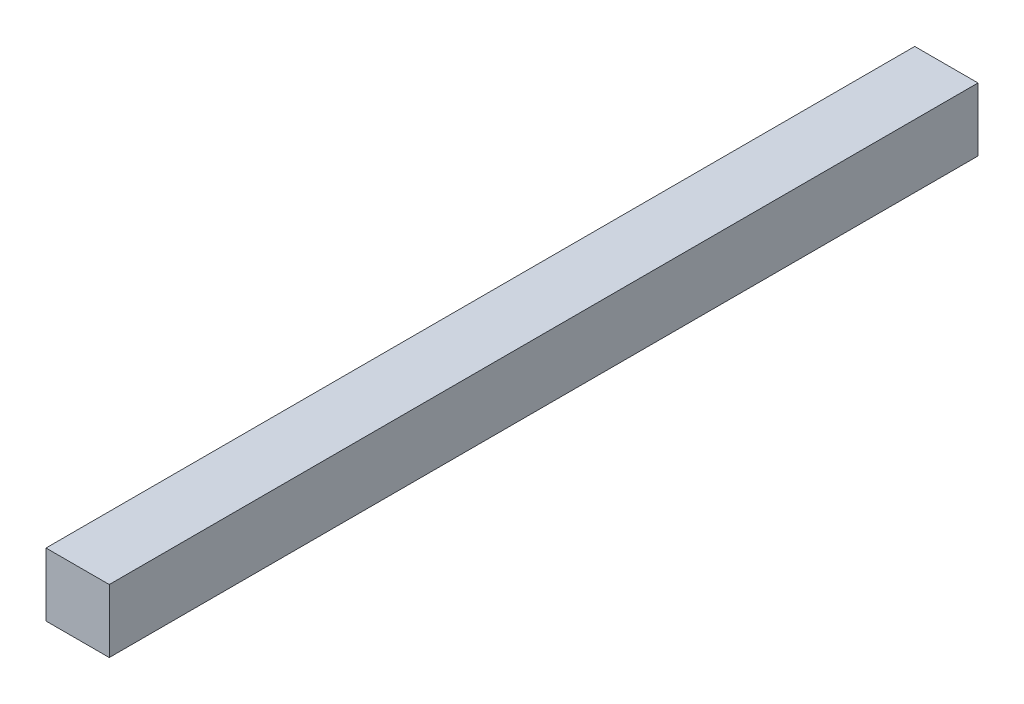
from build123d import *

# Parameters (mm, degrees)
SKETCH_1_W      = 30
SKETCH_1_H      = 30
EXTRUDE_1_DEPTH = 206


with BuildPart() as part:
    # 草图1 → 凸台-拉伸1 (new, symmetric)
    with BuildSketch(Plane.XY):
        Rectangle(SKETCH_1_W, SKETCH_1_H)
    extrude(amount=EXTRUDE_1_DEPTH, both=True)


solid = part.part
